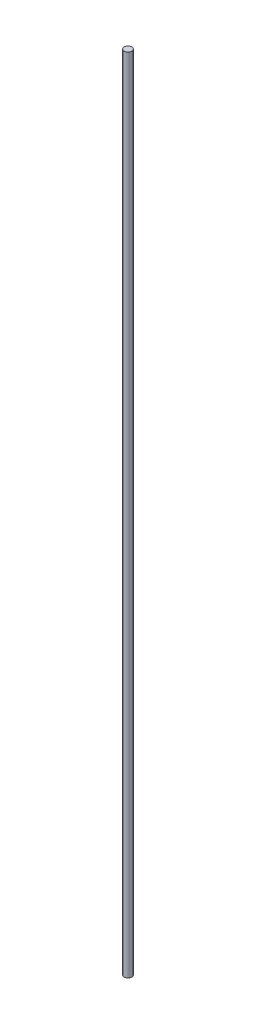
from build123d import *

# Parameters (mm, degrees)
SKETCH_1_R      = 1.59
EXTRUDE_1_DEPTH = 340.5


with BuildPart() as part:
    # Эскиз1 → Бобышка-Вытянуть1 (new body)
    with BuildSketch(Plane(origin=(0, 0, 0), x_dir=(1, 0, 0), z_dir=(0, 1, 0))):
        with Locations(Location((0, 0, 0), (0, 0, 270))):
            Circle(SKETCH_1_R)
    extrude(amount=EXTRUDE_1_DEPTH)


solid = part.part
